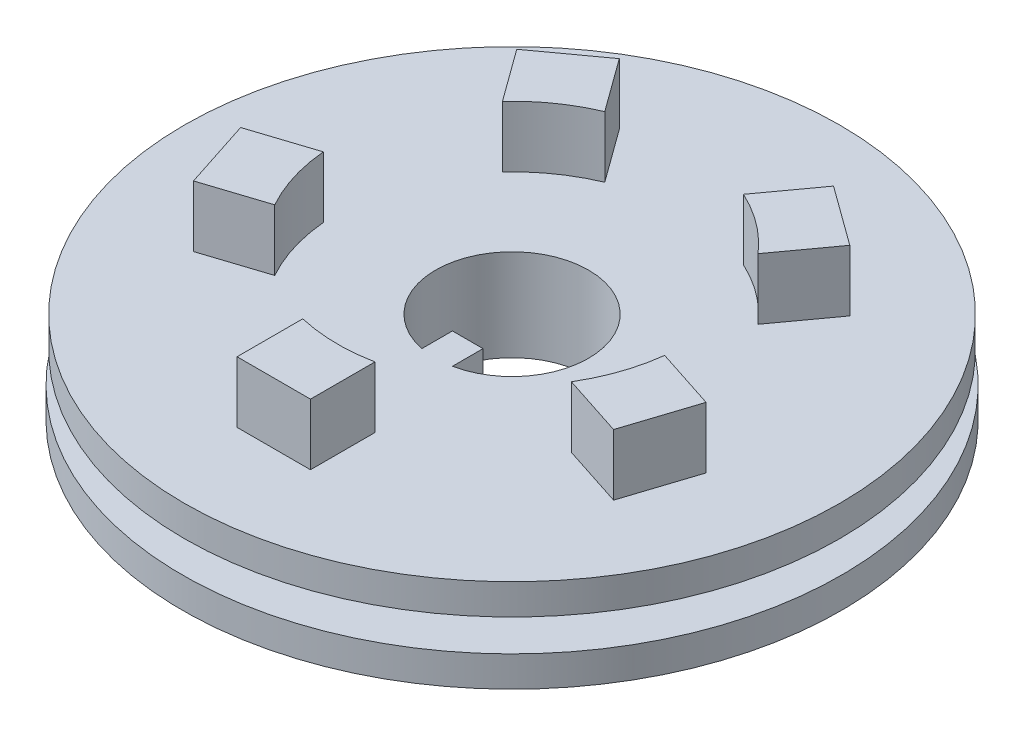
from build123d import *

# Parameters (mm, degrees)
BOSS_EXTRUDE1_START  = -15
BOSS_EXTRUDE1_DEPTH  = 15
BOSS_EXTRUDE2_DEPTH  = 10
CIRPATTERN1_COUNT    = 5
MIRROR3_COPY_1_DEPTH = 10
MIRROR3_COPY_2_DEPTH = 10
MIRROR3_COPY_3_DEPTH = 10
MIRROR3_COPY_4_DEPTH = 10


with BuildPart() as part:
    # Sketch1 → Revolve1 (revolve)
    with BuildSketch(Plane.YZ, mode=Mode.PRIVATE) as revolve1_sk:
        Polygon((-4.999994159, -22.251027603), (-4.999994159, 15.415581909), (5.841e-06, 15.415581909), (5.841e-06, 0.109652172), (5.000005841, 0.109652172), (5.000005841, 15.109652172), (10.000005841, 15.109652172), (10.000005841, 0.109652172), (10.000005841, -25.956139131), (-4.999994159, -25.956139131), align=None)
    revolve(revolve1_sk.sketch.rotate(Axis((0, -19.999999988, -38.456139131), (0, 1, 0)), 180), axis=Axis((0, -19.999999988, -38.456139131), (0, 1, 0)))

    # Sketch2 → Boss-Extrude1 (add)
    with BuildSketch(Plane(origin=(0, 10.000005841, 0), x_dir=(1, 0, 0), z_dir=(0, 1, 0)).offset(BOSS_EXTRUDE1_START)):
        with BuildLine():
            Line((-2.5, 31.208690417), (2.5, 31.208690417))
            Line((2.5, 31.208690417), (2.5, 26.208690417))
            ThreePointArc((2.5, 26.208690417), (0, 25.956139131), (-2.5, 26.208690417))
            Line((-2.5, 26.208690417), (-2.5, 31.208690417))
        make_face()
    extrude(amount=BOSS_EXTRUDE1_DEPTH)

    # Sketch3 → Boss-Extrude2 (add)
    with BuildSketch(Plane.XZ.offset(4.999994159)):
        with BuildLine():
            Line((-6.45112782, 0.043860869), (5.54887218, 0.043860869))
            Line((5.54887218, 0.043860869), (5.54887218, -10.496030583))
            ThreePointArc((5.54887218, -10.496030583), (-0.461398285, -9.956302999), (-6.45112782, -10.689649467))
            Line((-6.45112782, -10.689649467), (-6.45112782, 0.043860869))
        make_face()
    boss_extrude2 = extrude(amount=BOSS_EXTRUDE2_DEPTH)

    # CirPattern1: Boss-Extrude2 ×5 about axis
    cirpattern1_axis = Axis((0, 0, -38.456139131), (0, 1, 0))
    for i in range(1, CIRPATTERN1_COUNT):
        add(boss_extrude2.rotate(cirpattern1_axis, i * 360 / CIRPATTERN1_COUNT))

    # Mirror3: Boss-Extrude2 across plane
    add(boss_extrude2.mirror(Plane(origin=(0, 2.500005841, 0), x_dir=(0, 0, 1), z_dir=(0, -1, 0))))

    # Mirror3 copy 1 sketch → Mirror3 copy 1 (add)
    with BuildSketch(Plane(origin=(36.573961712, 10.000005841, -26.572538602), x_dir=(0.30901699437494745, 4.31570827698209e-15, -0.9510565162951535), z_dir=(0, 1, 0))):
        with BuildLine():
            Line((-6.45112782, -0.043860869), (5.54887218, -0.043860869))
            Line((5.54887218, -0.043860869), (5.54887218, 10.496030583))
            ThreePointArc((5.54887218, 10.496030583), (-0.461398285, 9.956302999), (-6.45112782, 10.689649467))
            Line((-6.45112782, 10.689649467), (-6.45112782, -0.043860869))
        make_face()
    extrude(amount=MIRROR3_COPY_1_DEPTH)

    # Mirror3 copy 2 sketch → Mirror3 copy 2 (add)
    with BuildSketch(Plane(origin=(22.603951441, 10.000005841, -69.567809226), x_dir=(-0.8090169943749473, -1.1298670954668355e-14, -0.5877852522924732), z_dir=(0, 1, 0))):
        with BuildLine():
            Line((-6.45112782, -0.043860869), (5.54887218, -0.043860869))
            Line((5.54887218, -0.043860869), (5.54887218, 10.496030583))
            ThreePointArc((5.54887218, 10.496030583), (-0.461398285, 9.956302999), (-6.45112782, 10.689649467))
            Line((-6.45112782, 10.689649467), (-6.45112782, -0.043860869))
        make_face()
    extrude(amount=MIRROR3_COPY_2_DEPTH)

    # Mirror3 copy 3 sketch → Mirror3 copy 3 (add)
    with BuildSketch(Plane(origin=(-22.603951441, 10.000005841, -69.567809226), x_dir=(-0.8090169943749476, -1.1298670954668358e-14, 0.587785252292473), z_dir=(0, 1, 0))):
        with BuildLine():
            Line((-6.45112782, -0.043860869), (5.54887218, -0.043860869))
            Line((5.54887218, -0.043860869), (5.54887218, 10.496030583))
            ThreePointArc((5.54887218, 10.496030583), (-0.461398285, 9.956302999), (-6.45112782, 10.689649467))
            Line((-6.45112782, 10.689649467), (-6.45112782, -0.043860869))
        make_face()
    extrude(amount=MIRROR3_COPY_3_DEPTH)

    # Mirror3 copy 4 sketch → Mirror3 copy 4 (add)
    with BuildSketch(Plane(origin=(-36.573961712, 10.000005841, -26.572538602), x_dir=(0.30901699437494723, 4.315708276982087e-15, 0.9510565162951536), z_dir=(0, 1, 0))):
        with BuildLine():
            Line((-6.45112782, -0.043860869), (5.54887218, -0.043860869))
            Line((5.54887218, -0.043860869), (5.54887218, 10.496030583))
            ThreePointArc((5.54887218, 10.496030583), (-0.461398285, 9.956302999), (-6.45112782, 10.689649467))
            Line((-6.45112782, 10.689649467), (-6.45112782, -0.043860869))
        make_face()
    extrude(amount=MIRROR3_COPY_4_DEPTH)


solid = part.part
